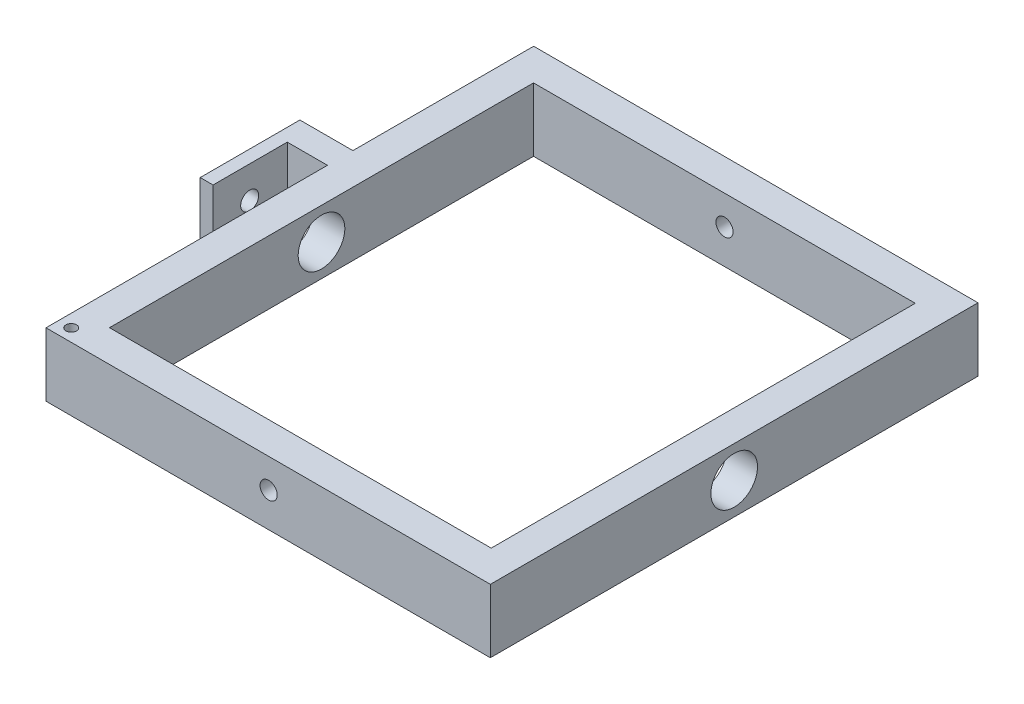
from build123d import *

# Parameters (mm, degrees)
SKETCH1_W            = 230
SKETCH1_H            = 230
SKETCH1_W_2          = 200
SKETCH1_H_2          = 200
BOSS_EXTRUDE1_DEPTH  = 30
SKETCH2_R            = 11
CUT_EXTRUDE3_DEPTH   = 206
SKETCH3_W            = 12.648408852
SKETCH3_H            = 30
BOSS_EXTRUDE2_DEPTH  = 28
SKETCH4_W            = 33.277006623
SKETCH4_H            = 30
BOSS_EXTRUDE4_DEPTH  = 41
SKETCH6_R            = 4
CUT_EXTRUDE4_DEPTH   = 218
SKETCH8_R            = 4.046690546
CUT_EXTRUDE6_DEPTH   = 280
CUT_EXTRUDE7_START   = -230
SKETCH9_R            = 11
CUT_EXTRUDE7_DEPTH   = 230
SKETCH11_W           = 19.776160892
SKETCH11_H           = 30
CUT_EXTRUDE8_DEPTH   = 41
SKETCH12_R           = 4
CUT_EXTRUDE9_DEPTH   = 264
SKETCH13_R           = 4
CUT_EXTRUDE10_DEPTH  = 264
SKETCH15_W           = 8.223839108
SKETCH15_H           = 30
CUT_EXTRUDE11_DEPTH  = 64
SKETCH16_W           = 6.512440182
SKETCH16_H           = 30
BOSS_EXTRUDE5_DEPTH  = 40
SKETCH17_R           = 4
CUT_EXTRUDE12_DEPTH  = 276
SKETCH18_W           = 10.028465144
SKETCH18_H           = 30
BOSS_EXTRUDE6_DEPTH  = 203
SKETCH19_W           = 9.920001469
SKETCH19_H           = 30
BOSS_EXTRUDE7_DEPTH  = 203
SKETCH21_W           = 19.776160892
SKETCH21_H           = 30
CUT_EXTRUDE13_DEPTH  = 203
SKETCH22_W           = 10.441032334
SKETCH22_H           = 30
CUT_EXTRUDE14_DEPTH  = 278
SKETCH23_W           = 4.062093177
SKETCH23_H           = 12.100968139
BOSS_EXTRUDE8_DEPTH  = 30
SKETCH24_W           = 9.989580678
SKETCH24_H           = 30
CUT_EXTRUDE15_DEPTH  = 248
CUT_EXTRUDE16_START  = -248
SKETCH25_R           = 11
CUT_EXTRUDE16_DEPTH  = 248
SKETCH26_W           = 12.005407817
SKETCH26_H           = 30
BOSS_EXTRUDE9_DEPTH  = 25
SKETCH27_W           = 9.568763957
SKETCH27_H           = 30
BOSS_EXTRUDE10_DEPTH = 35
SKETCH28_W           = 3.507869301
SKETCH28_H           = 30
CUT_EXTRUDE17_DEPTH  = 35
SKETCH29_R           = 4.25
CUT_EXTRUDE18_DEPTH  = 257
SKETCH33_R           = 2.5
CUT_EXTRUDE20_DEPTH  = 44


with BuildPart() as part:
    # Sketch1 → Boss-Extrude1 (new body)
    with BuildSketch(Plane(origin=(0, 0, 0), x_dir=(1, 0, 0), z_dir=(0, 1, 0))):
        Rectangle(SKETCH1_W, SKETCH1_H)
        Rectangle(SKETCH1_W_2, SKETCH1_H_2, mode=Mode.SUBTRACT)
    extrude(amount=BOSS_EXTRUDE1_DEPTH)

    # Sketch2 → Cut-Extrude3 (cut)
    with BuildSketch(Plane(origin=(115, 0, 0), x_dir=(0, 0, -1), z_dir=(1, 0, 0))):
        with Locations((0, 15)):
            Circle(SKETCH2_R)
    extrude(amount=-CUT_EXTRUDE3_DEPTH, mode=Mode.SUBTRACT)

    # Sketch3 → Boss-Extrude2 (add)
    with BuildSketch(Plane(origin=(115, 0, 0), x_dir=(0, 0, -1), z_dir=(1, 0, 0))):
        with Locations((26.610788675, 15)):
            Rectangle(SKETCH3_W, SKETCH3_H)
    extrude(amount=BOSS_EXTRUDE2_DEPTH)

    # Sketch4 → Boss-Extrude4 (add)
    with BuildSketch(Plane.XY.offset(-20.286584249)):
        with Locations((126.361496689, 15)):
            Rectangle(SKETCH4_W, SKETCH4_H)
    extrude(amount=BOSS_EXTRUDE4_DEPTH)

    # Sketch6 → Cut-Extrude4 (cut)
    with BuildSketch(Plane.ZY.offset(115)):
        with Locations((0, 15)):
            Circle(SKETCH6_R)
    extrude(amount=-CUT_EXTRUDE4_DEPTH, mode=Mode.SUBTRACT)

    # Sketch8 → Cut-Extrude6 (cut)
    with BuildSketch(Plane.XY.offset(115)):
        with Locations((0, 16.175919114)):
            Circle(SKETCH8_R)
    extrude(amount=-CUT_EXTRUDE6_DEPTH, mode=Mode.SUBTRACT)

    # Sketch9 → Cut-Extrude7 (cut)
    with BuildSketch(Plane.ZY.offset(115).offset(CUT_EXTRUDE7_START)):
        with Locations((0, 15)):
            Circle(SKETCH9_R)
    extrude(amount=CUT_EXTRUDE7_DEPTH, mode=Mode.SUBTRACT)

    # Sketch11 → Cut-Extrude8 (cut)
    with BuildSketch(Plane.XY.offset(20.713415751)):
        with Locations((124.888080446, 15)):
            Rectangle(SKETCH11_W, SKETCH11_H)
    extrude(amount=-CUT_EXTRUDE8_DEPTH, mode=Mode.SUBTRACT)

    # Sketch12 → Cut-Extrude9 (cut)
    with BuildSketch(Plane.ZY.offset(115)):
        with Locations((0, 15)):
            Circle(SKETCH12_R)
    extrude(amount=-CUT_EXTRUDE9_DEPTH, mode=Mode.SUBTRACT)

    # Sketch13 → Cut-Extrude10 (cut)
    with BuildSketch(Plane(origin=(0, 30, 0), x_dir=(1, 0, 0), z_dir=(0, 1, 0))):
        with Locations(Location((106.851068212, -106.17718303, 0), (0, 0, 270))):
            Circle(SKETCH13_R)
    extrude(amount=-CUT_EXTRUDE10_DEPTH, mode=Mode.SUBTRACT)

    # Sketch15 → Cut-Extrude11 (cut)
    with BuildSketch(Plane.XY.offset(20.713415751)):
        with Locations((138.888080446, 15)):
            Rectangle(SKETCH15_W, SKETCH15_H)
    extrude(amount=-CUT_EXTRUDE11_DEPTH, mode=Mode.SUBTRACT)

    # Sketch16 → Boss-Extrude5 (add)
    with BuildSketch(Plane.XY.offset(-20.286584249)):
        with Locations((131.519940801, 15)):
            Rectangle(SKETCH16_W, SKETCH16_H)
    extrude(amount=BOSS_EXTRUDE5_DEPTH)

    # Sketch17 → Cut-Extrude12 (cut)
    with BuildSketch(Plane.ZY.offset(115)):
        with Locations((0, 15)):
            Circle(SKETCH17_R)
    extrude(amount=-CUT_EXTRUDE12_DEPTH, mode=Mode.SUBTRACT)

    # Sketch18 → Boss-Extrude6 (add)
    with BuildSketch(Plane(origin=(0, 0, 100), x_dir=(-1, 0, 0), z_dir=(0, 0, -1))):
        with Locations((-94.985767428, 15)):
            Rectangle(SKETCH18_W, SKETCH18_H)
    extrude(amount=BOSS_EXTRUDE6_DEPTH)

    # Sketch19 → Boss-Extrude7 (add)
    with BuildSketch(Plane(origin=(0, 0, 100), x_dir=(-1, 0, 0), z_dir=(0, 0, -1))):
        with Locations((95.039999266, 15)):
            Rectangle(SKETCH19_W, SKETCH19_H)
    extrude(amount=BOSS_EXTRUDE7_DEPTH)

    # Sketch21 → Cut-Extrude13 (cut)
    with BuildSketch(Plane(origin=(0, 0, -32.934993101), x_dir=(-1, 0, 0), z_dir=(0, 0, -1))):
        with Locations((-124.888080446, 15)):
            Rectangle(SKETCH21_W, SKETCH21_H)
    extrude(amount=-CUT_EXTRUDE13_DEPTH, mode=Mode.SUBTRACT)

    # Sketch22 → Cut-Extrude14 (cut)
    with BuildSketch(Plane(origin=(0, 0, -115), x_dir=(-1, 0, 0), z_dir=(0, 0, -1))):
        with Locations((-109.779483833, 15)):
            Rectangle(SKETCH22_W, SKETCH22_H)
    extrude(amount=-CUT_EXTRUDE14_DEPTH, mode=Mode.SUBTRACT)

    # Sketch23 → Boss-Extrude8 (add)
    with BuildSketch(Plane(origin=(0, 30, 0), x_dir=(1, 0, 0), z_dir=(0, 1, 0))):
        with Locations((102.527921077, -108.949515931)):
            Rectangle(SKETCH23_W, SKETCH23_H)
    extrude(amount=-BOSS_EXTRUDE8_DEPTH)

    # Sketch24 → Cut-Extrude15 (cut)
    with BuildSketch(Plane(origin=(0, 0, -115), x_dir=(-1, 0, 0), z_dir=(0, 0, -1))):
        with Locations((110.005209661, 15)):
            Rectangle(SKETCH24_W, SKETCH24_H)
    extrude(amount=-CUT_EXTRUDE15_DEPTH, mode=Mode.SUBTRACT)

    # Sketch25 → Cut-Extrude16 (cut)
    with BuildSketch(Plane.ZY.offset(105.010419322).offset(CUT_EXTRUDE16_START)):
        with Locations(Location((0, 15, 0), (0, 0, 180))):
            Circle(SKETCH25_R)
    extrude(amount=CUT_EXTRUDE16_DEPTH, mode=Mode.SUBTRACT)

    # Sketch26 → Boss-Extrude9 (add)
    with BuildSketch(Plane.ZY.offset(105.010419322)):
        with Locations((-23.736715717, 15)):
            Rectangle(SKETCH26_W, SKETCH26_H)
    extrude(amount=BOSS_EXTRUDE9_DEPTH)

    # Sketch27 → Boss-Extrude10 (add)
    with BuildSketch(Plane.XY.offset(-17.734011808)):
        with Locations((-125.226037344, 15)):
            Rectangle(SKETCH27_W, SKETCH27_H)
    extrude(amount=BOSS_EXTRUDE10_DEPTH)

    # Sketch28 → Cut-Extrude17 (cut)
    with BuildSketch(Plane.XY.offset(17.265988192)):
        with Locations((-122.195590016, 15)):
            Rectangle(SKETCH28_W, SKETCH28_H)
    extrude(amount=-CUT_EXTRUDE17_DEPTH, mode=Mode.SUBTRACT)

    # Sketch29 → Cut-Extrude18 (cut)
    with BuildSketch(Plane(origin=(104.558967666, 0, 0), x_dir=(0, 0, -1), z_dir=(1, 0, 0))):
        with Locations((0, 15)):
            Circle(SKETCH29_R)
    extrude(amount=-CUT_EXTRUDE18_DEPTH, mode=Mode.SUBTRACT)

    # Sketch33 → Cut-Extrude20 (cut)
    with BuildSketch(Plane(origin=(0, 0, 0), x_dir=(-1, 0, 0), z_dir=(0, -1, 0))):
        with Locations(Location((99.023642446, -109.086175653, 0), (0, 0, 90))):
            Circle(SKETCH33_R)
    extrude(amount=-CUT_EXTRUDE20_DEPTH, mode=Mode.SUBTRACT)


solid = part.part
